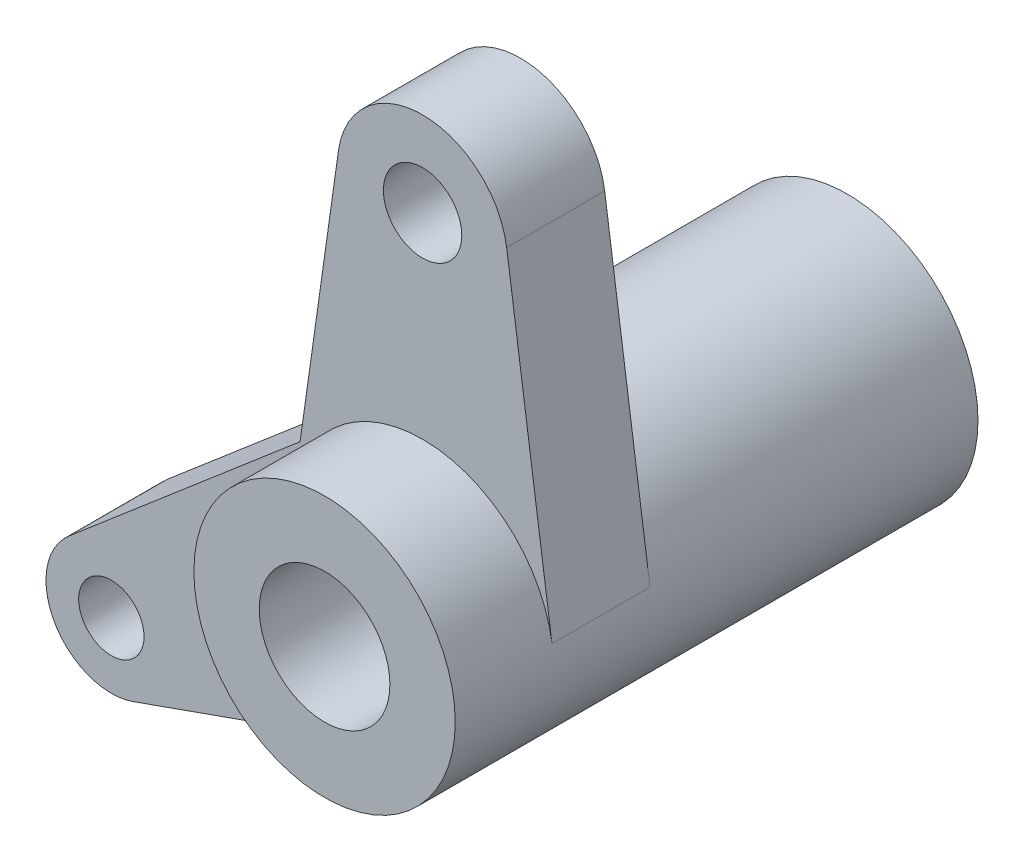
from build123d import *

# Parameters (mm, degrees)
SKETCH_1_R      = 10
EXTRUDE_1_DEPTH = 80
EXTRUDE_START   = -15
SKETCH_1_3_R    = 5
SKETCH_1_3_R_2  = 6
EXTRUDE_2_DEPTH = 15


with BuildPart() as part:
    # Эскиз1 → Бобышка-Вытянуть1 (new body)
    with BuildSketch(Plane.XY):
        with BuildLine():
            ThreePointArc((19.803030071, 2.8), (7.081980571, 18.704158661), (-12.982504947, 15.213630905))
            ThreePointArc((-12.982504947, 15.213630905), (-17.528473541, 9.630815923), (-19.803030071, 2.8))
            ThreePointArc((-19.803030071, 2.8), (-12.657286271, -15.485254414), (6.684138374, -18.849994541))
            ThreePointArc((6.684138374, -18.849994541), (16.335280339, -11.539437433), (20, 0))
            ThreePointArc((20, 0), (19.950696748, 1.403459757), (19.803030071, 2.8))
        make_face()
        Circle(SKETCH_1_R, mode=Mode.SUBTRACT)
    extrude(amount=-EXTRUDE_1_DEPTH)

    # Эскиз1<3> → Бобышка-Вытянуть2 (add)
    with BuildSketch(Plane.XY.offset(EXTRUDE_START)):
        with BuildLine():
            Line((-18.742862332, 10.29804772), (-54.122649682, -19.893184548))
            ThreePointArc((-54.122649682, -19.893184548), (-56.291651246, -32.5), (-44.289328021, -36.924997271))
            Line((-44.289328021, -36.924997271), (6.684138374, -18.849994541))
            ThreePointArc((6.684138374, -18.849994541), (-17.104768018, 10.364695414), (19.803030071, 2.8))
            Line((19.803030071, 2.8), (12.871969546, 51.82))
            ThreePointArc((12.871969546, 51.82), (0, 63), (-12.871969546, 51.82))
            Line((-12.871969546, 51.82), (-18.742862332, 10.29804772))
        make_face()
        with Locations((-47.631397208, -27.5)):
            Circle(SKETCH_1_3_R, mode=Mode.SUBTRACT)
        with Locations((0, 50)):
            Circle(SKETCH_1_3_R_2, mode=Mode.SUBTRACT)
    extrude(amount=-EXTRUDE_2_DEPTH)


solid = part.part
